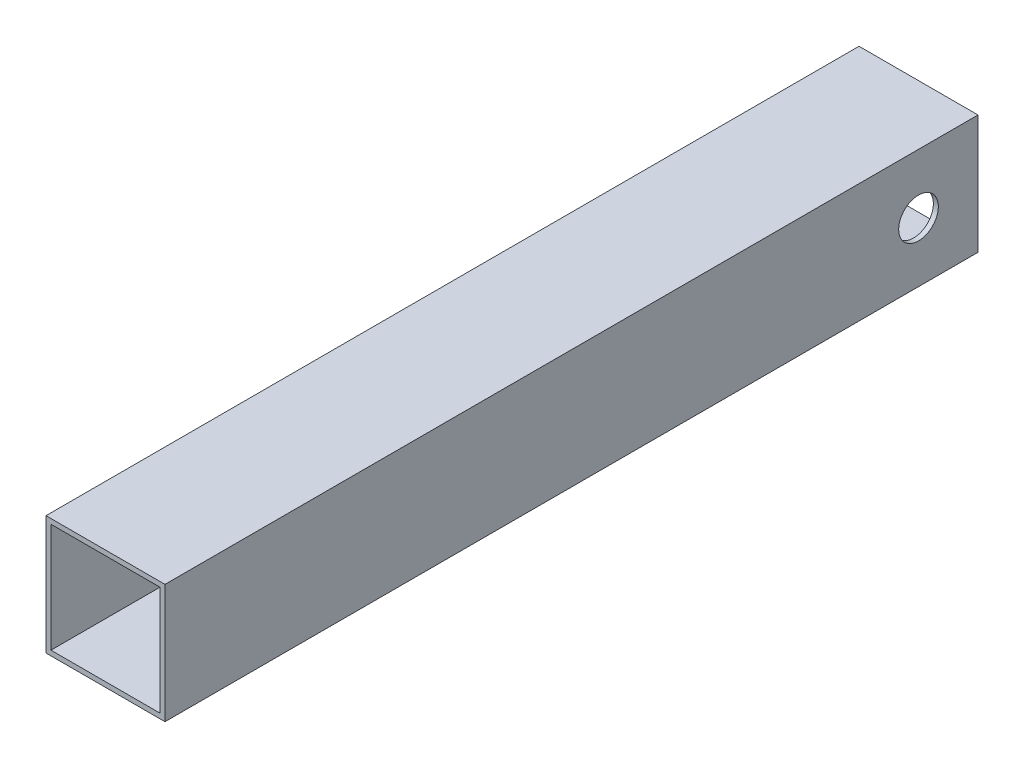
from build123d import *

# Parameters (mm, degrees)
SKETCH2_W                  = 38.1
SKETCH2_H                  = 38.1
SKETCH2_W_2                = 34.925
SKETCH2_H_2                = 34.925
BOSS_EXTRUDE1_DEPTH        = 260.35
F_1_2_0_5_DIAMETER_HOLE1_D = 12.7


with BuildPart() as part:
    # Sketch2 → Boss-Extrude1 (new body)
    with BuildSketch(Plane.XY):
        with Locations((19.05, 19.05)):
            Rectangle(SKETCH2_W, SKETCH2_H)
        with Locations((19.05, 19.05)):
            Rectangle(SKETCH2_W_2, SKETCH2_H_2, mode=Mode.SUBTRACT)
    extrude(amount=BOSS_EXTRUDE1_DEPTH)

    # 1/2 (0.5) Diameter Hole1 (through all)
    with Locations(Plane.ZY):
        with Locations((19.05, 19.05)):
            Hole(F_1_2_0_5_DIAMETER_HOLE1_D / 2)


solid = part.part
